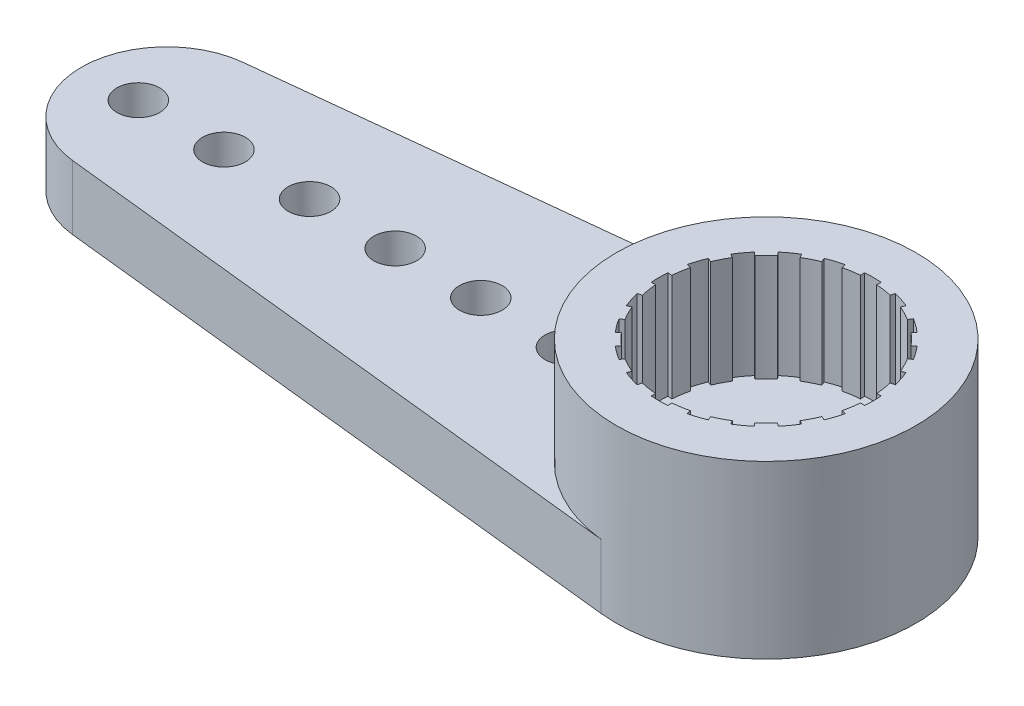
from build123d import *

# Parameters (mm, degrees)
SKETCH1_R           = 3.5
BOSS_EXTRUDE1_DEPTH = 4
SKETCH2_R           = 1
SKETCH2_R_2         = 0.5
BOSS_EXTRUDE2_DEPTH = 1.5
SKETCH3_R           = 2.25
CUT_EXTRUDE1_DEPTH  = 1


with BuildPart() as part:
    # Sketch1 → Boss-Extrude1 (new body)
    with BuildSketch(Plane(origin=(0, 0, 0), x_dir=(1, 0, 0), z_dir=(0, 1, 0))):
        with Locations(Location((0, 0, 0), (0, 0, 270))):
            Circle(SKETCH1_R)
        with BuildLine():
            Line((2.392601601, 0.18830183), (2.492293334, 0.196147739))
            ThreePointArc((2.492293334, 0.196147739), (2.5, 0), (2.492293334, -0.196147739))
            Line((2.492293334, -0.196147739), (2.392601601, -0.18830183))
            ThreePointArc((2.392601601, -0.18830183), (2.383364297, -0.282089754), (2.370452017, -0.375442716))
            ThreePointArc((2.370452017, -0.375442716), (2.353884673, -0.468216773), (2.333687809, -0.560268873))
            Line((2.333687809, -0.560268873), (2.430924801, -0.58361341))
            ThreePointArc((2.430924801, -0.58361341), (2.377641291, -0.772542486), (2.309698831, -0.956708581))
            Line((2.309698831, -0.956708581), (2.217310878, -0.918440238))
            ThreePointArc((2.217310878, -0.918440238), (2.179543617, -1.00478337), (2.138415658, -1.089577199))
            ThreePointArc((2.138415658, -1.089577199), (2.093990417, -1.17269098), (2.046336394, -1.253996555))
            Line((2.046336394, -1.253996555), (2.131600411, -1.306246412))
            ThreePointArc((2.131600411, -1.306246412), (2.022542486, -1.469463131), (1.901014914, -1.623620121))
            Line((1.901014914, -1.623620121), (1.824974317, -1.558675316))
            ThreePointArc((1.824974317, -1.558675316), (1.762374023, -1.629121789), (1.697056275, -1.697056275))
            ThreePointArc((1.697056275, -1.697056275), (1.629121789, -1.762374023), (1.558675316, -1.824974317))
            Line((1.558675316, -1.824974317), (1.623620121, -1.901014914))
            ThreePointArc((1.623620121, -1.901014914), (1.469463131, -2.022542486), (1.306246412, -2.131600411))
            Line((1.306246412, -2.131600411), (1.253996555, -2.046336394))
            ThreePointArc((1.253996555, -2.046336394), (1.17269098, -2.093990417), (1.089577199, -2.138415658))
            ThreePointArc((1.089577199, -2.138415658), (1.00478337, -2.179543617), (0.918440238, -2.217310878))
            Line((0.918440238, -2.217310878), (0.956708581, -2.309698831))
            ThreePointArc((0.956708581, -2.309698831), (0.772542486, -2.377641291), (0.58361341, -2.430924801))
            Line((0.58361341, -2.430924801), (0.560268873, -2.333687809))
            ThreePointArc((0.560268873, -2.333687809), (0.468216773, -2.353884673), (0.375442716, -2.370452017))
            ThreePointArc((0.375442716, -2.370452017), (0.282089754, -2.383364297), (0.18830183, -2.392601601))
            Line((0.18830183, -2.392601601), (0.196147739, -2.492293334))
            ThreePointArc((0.196147739, -2.492293334), (0, -2.5), (-0.196147739, -2.492293334))
            Line((-0.196147739, -2.492293334), (-0.18830183, -2.392601601))
            ThreePointArc((-0.18830183, -2.392601601), (-0.282089754, -2.383364297), (-0.375442716, -2.370452017))
            ThreePointArc((-0.375442716, -2.370452017), (-0.468216773, -2.353884673), (-0.560268873, -2.333687809))
            Line((-0.560268873, -2.333687809), (-0.58361341, -2.430924801))
            ThreePointArc((-0.58361341, -2.430924801), (-0.772542486, -2.377641291), (-0.956708581, -2.309698831))
            Line((-0.956708581, -2.309698831), (-0.918440238, -2.217310878))
            ThreePointArc((-0.918440238, -2.217310878), (-1.00478337, -2.179543617), (-1.089577199, -2.138415658))
            ThreePointArc((-1.089577199, -2.138415658), (-1.17269098, -2.093990417), (-1.253996555, -2.046336394))
            Line((-1.253996555, -2.046336394), (-1.306246412, -2.131600411))
            ThreePointArc((-1.306246412, -2.131600411), (-1.469463131, -2.022542486), (-1.623620121, -1.901014914))
            Line((-1.623620121, -1.901014914), (-1.558675316, -1.824974317))
            ThreePointArc((-1.558675316, -1.824974317), (-1.629121789, -1.762374023), (-1.697056275, -1.697056275))
            ThreePointArc((-1.697056275, -1.697056275), (-1.762374023, -1.629121789), (-1.824974317, -1.558675316))
            Line((-1.824974317, -1.558675316), (-1.901014914, -1.623620121))
            ThreePointArc((-1.901014914, -1.623620121), (-2.022542486, -1.469463131), (-2.131600411, -1.306246412))
            Line((-2.131600411, -1.306246412), (-2.046336394, -1.253996555))
            ThreePointArc((-2.046336394, -1.253996555), (-2.093990417, -1.17269098), (-2.138415658, -1.089577199))
            ThreePointArc((-2.138415658, -1.089577199), (-2.179543617, -1.00478337), (-2.217310878, -0.918440238))
            Line((-2.217310878, -0.918440238), (-2.309698831, -0.956708581))
            ThreePointArc((-2.309698831, -0.956708581), (-2.377641291, -0.772542486), (-2.430924801, -0.58361341))
            Line((-2.430924801, -0.58361341), (-2.333687809, -0.560268873))
            ThreePointArc((-2.333687809, -0.560268873), (-2.353884673, -0.468216773), (-2.370452017, -0.375442716))
            ThreePointArc((-2.370452017, -0.375442716), (-2.383364297, -0.282089754), (-2.392601601, -0.18830183))
            Line((-2.392601601, -0.18830183), (-2.492293334, -0.196147739))
            ThreePointArc((-2.492293334, -0.196147739), (-2.5, 0), (-2.492293334, 0.196147739))
            Line((-2.492293334, 0.196147739), (-2.392601601, 0.18830183))
            ThreePointArc((-2.392601601, 0.18830183), (-2.383364297, 0.282089754), (-2.370452017, 0.375442716))
            ThreePointArc((-2.370452017, 0.375442716), (-2.353884673, 0.468216773), (-2.333687809, 0.560268873))
            Line((-2.333687809, 0.560268873), (-2.430924801, 0.58361341))
            ThreePointArc((-2.430924801, 0.58361341), (-2.377641291, 0.772542486), (-2.309698831, 0.956708581))
            Line((-2.309698831, 0.956708581), (-2.217310878, 0.918440238))
            ThreePointArc((-2.217310878, 0.918440238), (-2.179543617, 1.00478337), (-2.138415658, 1.089577199))
            ThreePointArc((-2.138415658, 1.089577199), (-2.093990417, 1.17269098), (-2.046336394, 1.253996555))
            Line((-2.046336394, 1.253996555), (-2.131600411, 1.306246412))
            ThreePointArc((-2.131600411, 1.306246412), (-2.022542486, 1.469463131), (-1.901014914, 1.623620121))
            Line((-1.901014914, 1.623620121), (-1.824974317, 1.558675316))
            ThreePointArc((-1.824974317, 1.558675316), (-1.762374023, 1.629121789), (-1.697056275, 1.697056275))
            ThreePointArc((-1.697056275, 1.697056275), (-1.629121789, 1.762374023), (-1.558675316, 1.824974317))
            Line((-1.558675316, 1.824974317), (-1.623620121, 1.901014914))
            ThreePointArc((-1.623620121, 1.901014914), (-1.469463131, 2.022542486), (-1.306246412, 2.131600411))
            Line((-1.306246412, 2.131600411), (-1.253996555, 2.046336394))
            ThreePointArc((-1.253996555, 2.046336394), (-1.17269098, 2.093990417), (-1.089577199, 2.138415658))
            ThreePointArc((-1.089577199, 2.138415658), (-1.00478337, 2.179543617), (-0.918440238, 2.217310878))
            Line((-0.918440238, 2.217310878), (-0.956708581, 2.309698831))
            ThreePointArc((-0.956708581, 2.309698831), (-0.772542486, 2.377641291), (-0.58361341, 2.430924801))
            Line((-0.58361341, 2.430924801), (-0.560268873, 2.333687809))
            ThreePointArc((-0.560268873, 2.333687809), (-0.468216773, 2.353884673), (-0.375442716, 2.370452017))
            ThreePointArc((-0.375442716, 2.370452017), (-0.282089754, 2.383364297), (-0.18830183, 2.392601601))
            Line((-0.18830183, 2.392601601), (-0.196147739, 2.492293334))
            ThreePointArc((-0.196147739, 2.492293334), (0, 2.5), (0.196147739, 2.492293334))
            Line((0.196147739, 2.492293334), (0.18830183, 2.392601601))
            ThreePointArc((0.18830183, 2.392601601), (0.282089754, 2.383364297), (0.375442716, 2.370452017))
            ThreePointArc((0.375442716, 2.370452017), (0.468216773, 2.353884673), (0.560268873, 2.333687809))
            Line((0.560268873, 2.333687809), (0.58361341, 2.430924801))
            ThreePointArc((0.58361341, 2.430924801), (0.772542486, 2.377641291), (0.956708581, 2.309698831))
            Line((0.956708581, 2.309698831), (0.918440238, 2.217310878))
            ThreePointArc((0.918440238, 2.217310878), (1.00478337, 2.179543617), (1.089577199, 2.138415658))
            ThreePointArc((1.089577199, 2.138415658), (1.17269098, 2.093990417), (1.253996555, 2.046336394))
            Line((1.253996555, 2.046336394), (1.306246412, 2.131600411))
            ThreePointArc((1.306246412, 2.131600411), (1.469463131, 2.022542486), (1.623620121, 1.901014914))
            Line((1.623620121, 1.901014914), (1.558675316, 1.824974317))
            ThreePointArc((1.558675316, 1.824974317), (1.629121789, 1.762374023), (1.697056275, 1.697056275))
            ThreePointArc((1.697056275, 1.697056275), (1.762374023, 1.629121789), (1.824974317, 1.558675316))
            Line((1.824974317, 1.558675316), (1.901014914, 1.623620121))
            ThreePointArc((1.901014914, 1.623620121), (2.022542486, 1.469463131), (2.131600411, 1.306246412))
            Line((2.131600411, 1.306246412), (2.046336394, 1.253996555))
            ThreePointArc((2.046336394, 1.253996555), (2.093990417, 1.17269098), (2.138415658, 1.089577199))
            ThreePointArc((2.138415658, 1.089577199), (2.179543617, 1.00478337), (2.217310878, 0.918440238))
            Line((2.217310878, 0.918440238), (2.309698831, 0.956708581))
            ThreePointArc((2.309698831, 0.956708581), (2.377641291, 0.772542486), (2.430924801, 0.58361341))
            Line((2.430924801, 0.58361341), (2.333687809, 0.560268873))
            ThreePointArc((2.333687809, 0.560268873), (2.353884673, 0.468216773), (2.370452017, 0.375442716))
            ThreePointArc((2.370452017, 0.375442716), (2.383364297, 0.282089754), (2.392601601, 0.18830183))
        make_face(mode=Mode.SUBTRACT)
    extrude(amount=BOSS_EXTRUDE1_DEPTH)

    # Sketch2 → Boss-Extrude2 (add)
    with BuildSketch(Plane.XZ):
        with BuildLine():
            Line((-14.214285714, 1.988487272), (-0.375, 3.479852727))
            ThreePointArc((-0.375, 3.479852727), (3.5, 0), (-0.375, -3.479852727))
            Line((-0.375, -3.479852727), (-14.214285714, -1.988487272))
            ThreePointArc((-14.214285714, -1.988487272), (-16, 0), (-14.214285714, 1.988487272))
        make_face()
        with Locations(Location((0, 0, 0), (0, 0, 270))):
            Circle(SKETCH2_R, mode=Mode.SUBTRACT)
        with Locations(Location((-14.667614311, 0, 0), (0, 0, 270))):
            Circle(SKETCH2_R_2, mode=Mode.SUBTRACT)
        with Locations(Location((-12.667614311, 0, 0), (0, 0, 270))):
            Circle(SKETCH2_R_2, mode=Mode.SUBTRACT)
        with Locations(Location((-10.667614311, 0, 0), (0, 0, 270))):
            Circle(SKETCH2_R_2, mode=Mode.SUBTRACT)
        with Locations(Location((-8.667614311, 0, 0), (0, 0, 270))):
            Circle(SKETCH2_R_2, mode=Mode.SUBTRACT)
        with Locations(Location((-6.667614311, 0, 0), (0, 0, 270))):
            Circle(SKETCH2_R_2, mode=Mode.SUBTRACT)
        with Locations(Location((-4.667614311, 0, 0), (0, 0, 270))):
            Circle(SKETCH2_R_2, mode=Mode.SUBTRACT)
    extrude(amount=-BOSS_EXTRUDE2_DEPTH)

    # Sketch3 → Cut-Extrude1 (cut)
    with BuildSketch(Plane(origin=(0, 0, 0), x_dir=(-1, 0, 0), z_dir=(0, -1, 0))):
        with Locations(Location((0, 0, 0), (0, 0, 90))):
            Circle(SKETCH3_R)
    extrude(amount=-CUT_EXTRUDE1_DEPTH, mode=Mode.SUBTRACT)


solid = part.part
